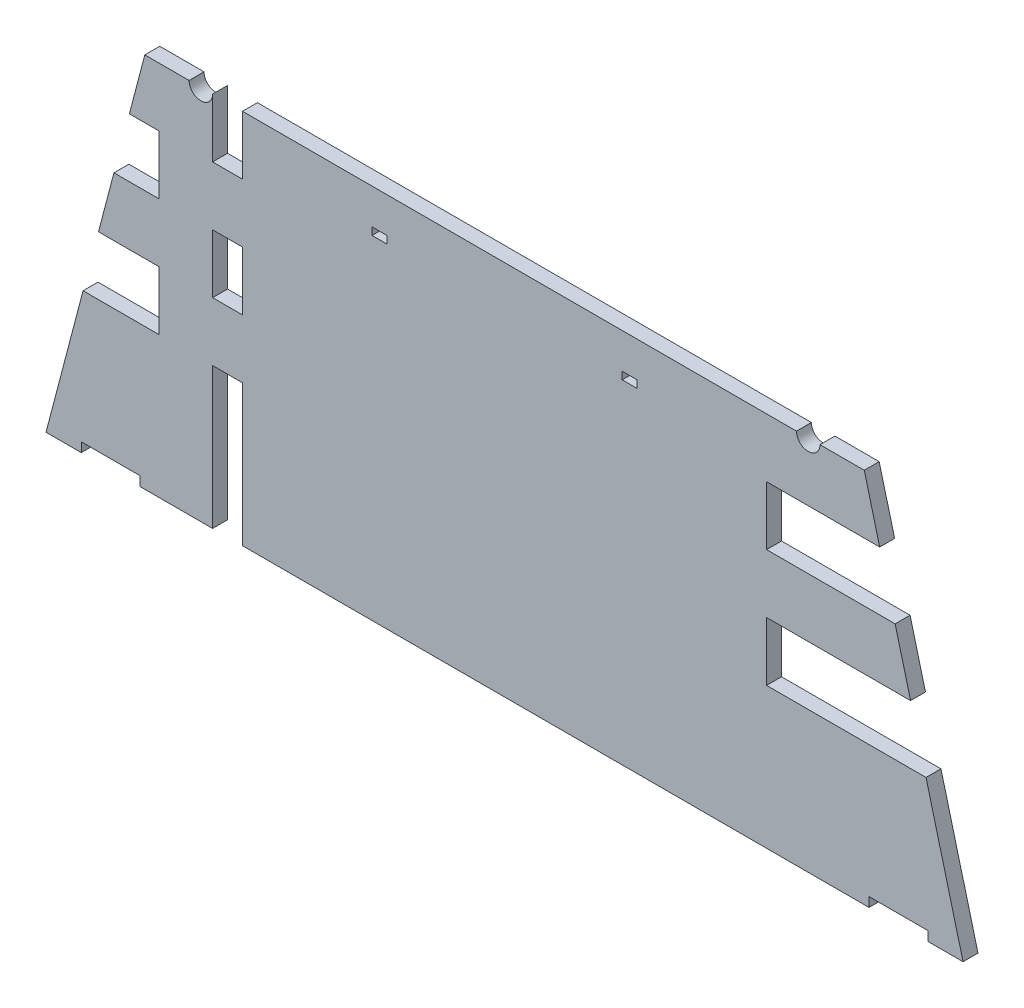
from build123d import *

# Parameters (mm, degrees)
SKETCH1_W      = 6.35
SKETCH1_H      = 3.175
SKETCH1_W_2    = 12.7
SKETCH1_H_2    = 25
EXTRUDE1_DEPTH = 6.35


with BuildPart() as part:
    # Sketch1 → Extrude1 (new body)
    with BuildSketch(Plane.XY):
        with BuildLine():
            Line((-155, 0), (-155, 4))
            Line((-155, 4), (-180, 4))
            Line((-180, 4), (-180, 0))
            Line((-180, 0), (-195, 0))
            Line((-195, 0), (-179.241666667, 60))
            Line((-179.241666667, 60), (-146.84375, 60))
            Line((-146.84375, 60), (-146.84375, 85))
            Line((-146.84375, 85), (-172.675694444, 85))
            Line((-172.675694444, 85), (-166.109722222, 110))
            Line((-166.109722222, 110), (-146.84375, 110))
            Line((-146.84375, 110), (-146.84375, 135))
            Line((-146.84375, 135), (-159.54375, 135))
            Line((-159.54375, 135), (-152.977777778, 160))
            Line((-152.977777778, 160), (-134.14375, 160))
            ThreePointArc((-134.14375, 160), (-129.14375, 155), (-124.14375, 160))
            Line((-124.14375, 160), (-124.14375, 135))
            Line((-124.14375, 135), (-111.44375, 135))
            Line((-111.44375, 135), (-111.44375, 160))
            Line((-111.44375, 160), (0, 160))
            Line((0, 160), (124.14375, 160))
            ThreePointArc((124.14375, 160), (129.14375, 155), (134.14375, 160))
            Line((134.14375, 160), (152.977777778, 160))
            Line((152.977777778, 160), (159.54375, 135))
            Line((159.54375, 135), (111.44375, 135))
            Line((111.44375, 135), (111.44375, 110))
            Line((111.44375, 110), (166.109722222, 110))
            Line((166.109722222, 110), (172.675694444, 85))
            Line((172.675694444, 85), (111.44375, 85))
            Line((111.44375, 85), (111.44375, 60))
            Line((111.44375, 60), (179.241666667, 60))
            Line((179.241666667, 60), (195, 0))
            Line((195, 0), (180, 0))
            Line((180, 0), (180, 4))
            Line((180, 4), (155, 4))
            Line((155, 4), (155, 0))
            Line((155, 0), (-111.44375, 0))
            Line((-111.44375, 0), (-111.44375, 60))
            Line((-111.44375, 60), (-124.14375, 60))
            Line((-124.14375, 60), (-124.14375, 0))
            Line((-124.14375, 0), (-155, 0))
        make_face()
        with Locations((-53.175, 143.4125)):
            Rectangle(SKETCH1_W, SKETCH1_H, mode=Mode.SUBTRACT)
        with Locations((-117.79375, 97.5)):
            Rectangle(SKETCH1_W_2, SKETCH1_H_2, mode=Mode.SUBTRACT)
        with Locations((53.175, 143.4125)):
            Rectangle(SKETCH1_W, SKETCH1_H, mode=Mode.SUBTRACT)
    extrude(amount=EXTRUDE1_DEPTH)


solid = part.part
